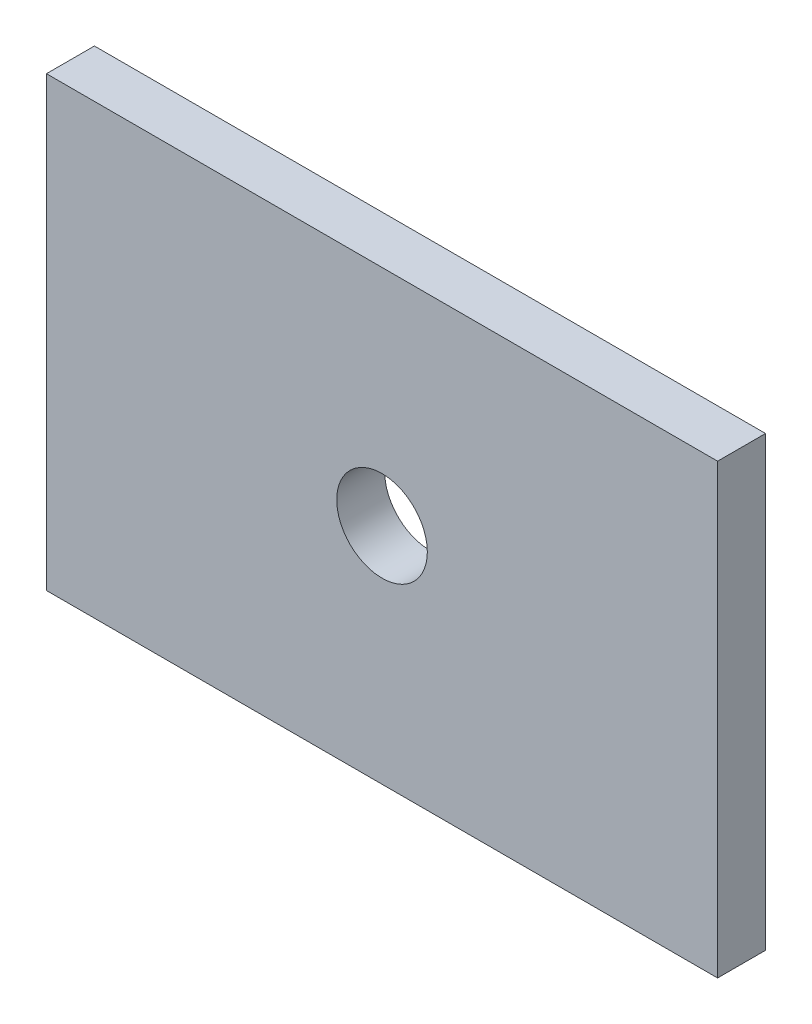
from build123d import *

# Parameters (mm, degrees)
SKETCH1_W           = 66.6496
SKETCH1_H           = 44.45
BOSS_EXTRUDE1_DEPTH = 4.7625
SKETCH2_R           = 4.5
CUT_EXTRUDE1_DEPTH  = 81.253679582


with BuildPart() as part:
    # Sketch1 → Boss-Extrude1 (new body)
    with BuildSketch(Plane.XY):
        with Locations((33.3248, 22.225)):
            Rectangle(SKETCH1_W, SKETCH1_H)
    extrude(amount=BOSS_EXTRUDE1_DEPTH)

    # Sketch2 → Cut-Extrude1 (cut, through all)
    with BuildSketch(Plane.XY.offset(4.7625)):
        with Locations((33.3248, 22.225)):
            Circle(SKETCH2_R)
    extrude(amount=-CUT_EXTRUDE1_DEPTH, mode=Mode.SUBTRACT)


solid = part.part
